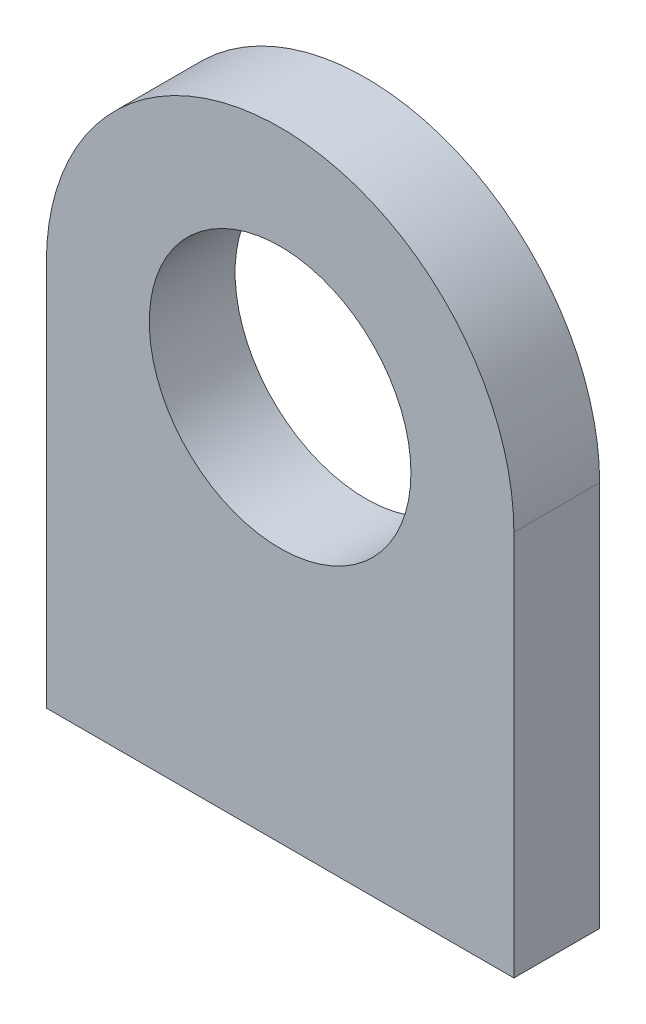
from build123d import *

# Parameters (mm, degrees)
SKETCH_1_R      = 6.1
EXTRUDE_1_DEPTH = 4


with BuildPart() as part:
    # 스케치1 → 보스-돌출1 (new body)
    with BuildSketch(Plane.XY):
        with BuildLine():
            Line((-10.9, 20.333989173), (-10.9, 2.333989173))
            Line((-10.9, 2.333989173), (-8.65, 2.333989173))
            Line((-8.65, 2.333989173), (8.65, 2.333989173))
            Line((8.65, 2.333989173), (10.9, 2.333989173))
            Line((10.9, 2.333989173), (10.9, 20.333989173))
            ThreePointArc((10.9, 20.333989173), (0, 31.233989173), (-10.9, 20.333989173))
        make_face()
        with Locations((0, 20.333989173)):
            Circle(SKETCH_1_R, mode=Mode.SUBTRACT)
    extrude(amount=EXTRUDE_1_DEPTH)


solid = part.part
